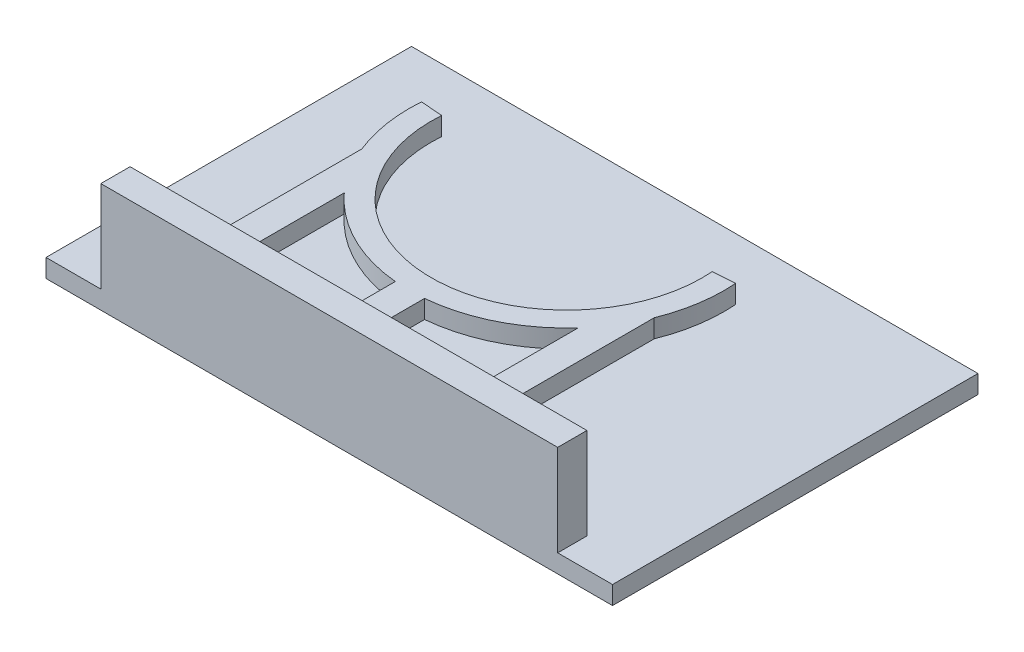
from build123d import *

# Parameters (mm, degrees)
SKETCH_1_W               = 155
SKETCH_1_H               = 100
EXTRUDE_1_DEPTH          = 5
SKETCH_2_W               = 125
SKETCH_2_H               = 8
EXTRUDE_2_DEPTH          = 25
EXTRUDE_6_DEPTH          = 20
EXTRUDE_7_REACH          = 184.727
EXTRUDE_7_END_RADIUS     = 43.11234224
SKETCH_11_W              = 8
SKETCH_11_H              = 5
SKETCH_12_W              = 125
SKETCH_12_H              = 15
CUT_EXTRUDE_1_DEPTH      = 130
PATTERN_CIRCULAR_1_COUNT = 5
PATTERN_CIRCULAR_1_ANGLE = 90
F_1_THE_OTHER_WAY_COUNT  = 5
F_1_THE_OTHER_WAY_ANGLE  = 90


with BuildPart() as part:
    # 草图1 → 凸台-拉伸1 (new body)
    with BuildSketch(Plane(origin=(0, 0, 0), x_dir=(1, 0, 0), z_dir=(0, 1, 0))):
        with Locations((77.5, 50)):
            Rectangle(SKETCH_1_W, SKETCH_1_H)
    extrude(amount=EXTRUDE_1_DEPTH)

    # 草图2 → 凸台-拉伸2 (add)
    with BuildSketch(Plane(origin=(0, 5, 0), x_dir=(1, 0, 0), z_dir=(0, 1, 0))):
        with Locations((77.5, 4)):
            Rectangle(SKETCH_2_W, SKETCH_2_H)
    extrude(amount=EXTRUDE_2_DEPTH)

    # 草图7 → 凸台-拉伸6 (add)
    with BuildSketch(Plane(origin=(0, 5, 0), x_dir=(1, 0, 0), z_dir=(0, 1, 0))):
        with BuildLine():
            Line((34.50840207, 68.224369845), (40.49159793, 67.775630155))
            ThreePointArc((40.49159793, 67.775630155), (77.5, 27.88765776), (114.50840207, 67.775630155))
            Line((114.50840207, 67.775630155), (120.49159793, 68.224369845))
            ThreePointArc((120.49159793, 68.224369845), (77.5, 21.88765776), (34.50840207, 68.224369845))
        make_face()
    extrude(amount=EXTRUDE_6_DEPTH)

    # 凸台-拉伸7: up to this cylinder (the profile starts outside it)
    extrude_7_end = Plane(origin=(77.5, 22.5, -65), z_dir=(0, -1, 0)) * Cylinder(EXTRUDE_7_END_RADIUS, 456.67868448, mode=Mode.PRIVATE)
    # 草图11 → 凸台-拉伸7 (add, up to the surface)
    with BuildSketch(Plane(origin=(0, 0, -8), x_dir=(-1, 0, 0), z_dir=(0, 0, -1)), mode=Mode.PRIVATE) as extrude_7_sk1:
        with Locations((-77.5, 22.5)):
            Rectangle(SKETCH_11_W, SKETCH_11_H)
    extrude_7_tool1 = extrude(extrude_7_sk1.sketch, amount=EXTRUDE_7_REACH, mode=Mode.PRIVATE) - extrude_7_end
    add(extrude_7_tool1.solids().sort_by_distance((77.5, 22.5, -8))[0])
    # 草图11 → 凸台-拉伸7 (add, up to the surface)
    with BuildSketch(Plane(origin=(0, 0, -8), x_dir=(-1, 0, 0), z_dir=(0, 0, -1)), mode=Mode.PRIVATE) as extrude_7_sk2:
        with Locations((-41.5, 22.5)):
            Rectangle(SKETCH_11_W, SKETCH_11_H)
    extrude_7_tool2 = extrude(extrude_7_sk2.sketch, amount=EXTRUDE_7_REACH, mode=Mode.PRIVATE) - extrude_7_end
    add(extrude_7_tool2.solids().sort_by_distance((41.5, 22.5, -8))[0])
    # 草图11 → 凸台-拉伸7 (add, up to the surface)
    with BuildSketch(Plane(origin=(0, 0, -8), x_dir=(-1, 0, 0), z_dir=(0, 0, -1)), mode=Mode.PRIVATE) as extrude_7_sk3:
        with Locations((-113.5, 22.5)):
            Rectangle(SKETCH_11_W, SKETCH_11_H)
    extrude_7_tool3 = extrude(extrude_7_sk3.sketch, amount=EXTRUDE_7_REACH, mode=Mode.PRIVATE) - extrude_7_end
    add(extrude_7_tool3.solids().sort_by_distance((113.5, 22.5, -8))[0])

    # 草图12 → 切除-拉伸1 (cut)
    with BuildSketch(Plane(origin=(0, 0, -8), x_dir=(-1, 0, 0), z_dir=(0, 0, -1))):
        with Locations((-77.5, 12.5)):
            Rectangle(SKETCH_12_W, SKETCH_12_H)
    extrude(amount=CUT_EXTRUDE_1_DEPTH, mode=Mode.SUBTRACT)

    # 草图16 → 切除-旋转3 (revolve, cut)
    with BuildSketch(Plane(origin=(0, 18, 0), x_dir=(-1, 0, 0), z_dir=(0, -1, 0))):
        with BuildLine():
            Line((-80.5, 25), (-74.5, 25))
            ThreePointArc((-74.5, 25), (-77.5, 22), (-80.5, 25))
        make_face()
    cut_revolve_3 = revolve(axis=Axis((74.5, 18, -25), (1, 0, 0)), mode=Mode.SUBTRACT)

    # 阵列(圆周)1: 切除-旋转3 ×5 about axis
    pattern_circular_1_axis = Axis((77.5, 0, -65), (0, -1, 0))
    for i in range(1, PATTERN_CIRCULAR_1_COUNT):
        add(cut_revolve_3.rotate(pattern_circular_1_axis, i * PATTERN_CIRCULAR_1_ANGLE / (PATTERN_CIRCULAR_1_COUNT - 1)), mode=Mode.SUBTRACT)

    # 1 the other way: 切除-旋转3 ×5 about axis
    f_1_the_other_way_axis = Axis((77.5, 0, -65), (0, 1, 0))
    for i in range(1, F_1_THE_OTHER_WAY_COUNT):
        add(cut_revolve_3.rotate(f_1_the_other_way_axis, i * F_1_THE_OTHER_WAY_ANGLE / (F_1_THE_OTHER_WAY_COUNT - 1)), mode=Mode.SUBTRACT)


solid = part.part
